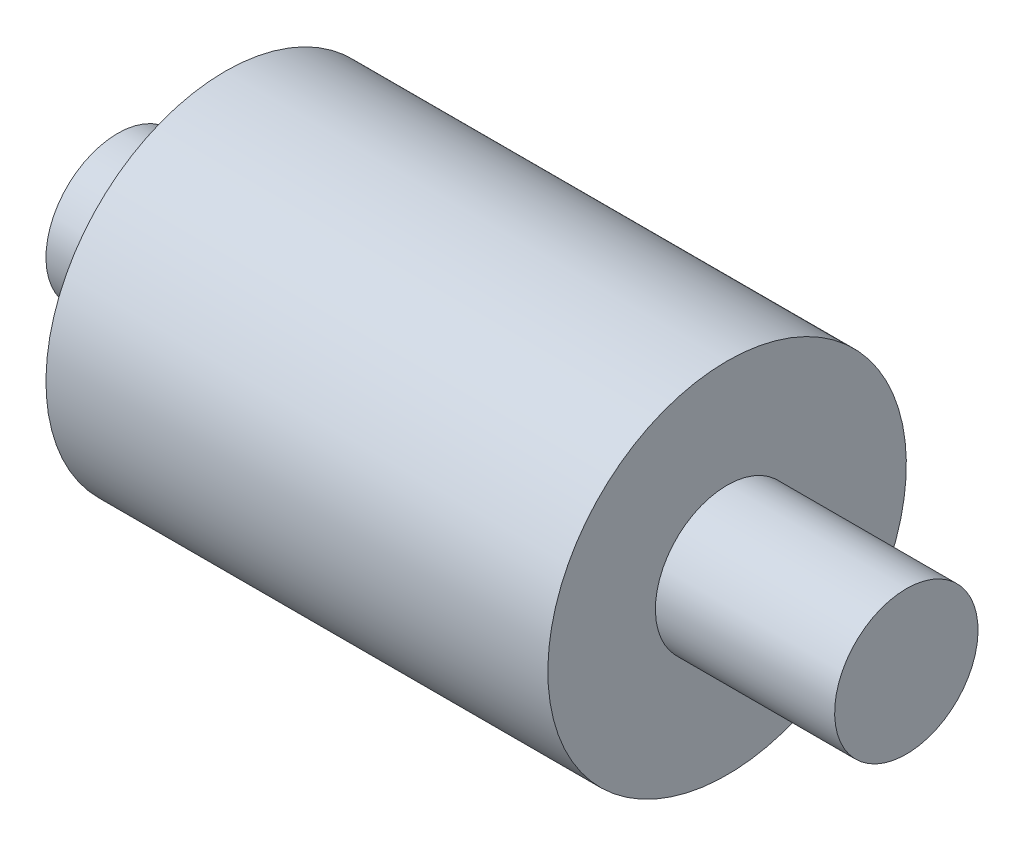
from build123d import *


with BuildPart() as part:
    # Schizzo1 → Rivoluzione1 (revolve)
    with BuildSketch(Plane.XY):
        Polygon((-38.291065144, 0), (-35.291065144, 0), (-35.291065144, 3), (-21.291065144, 3), (-21.291065144, 0), (-16.291065144, 0), (-16.291065144, -2), (-38.291065144, -2), align=None)
    revolve(axis=Axis((-16.291065144, -2, 0), (-1, 0, 0)))


solid = part.part
